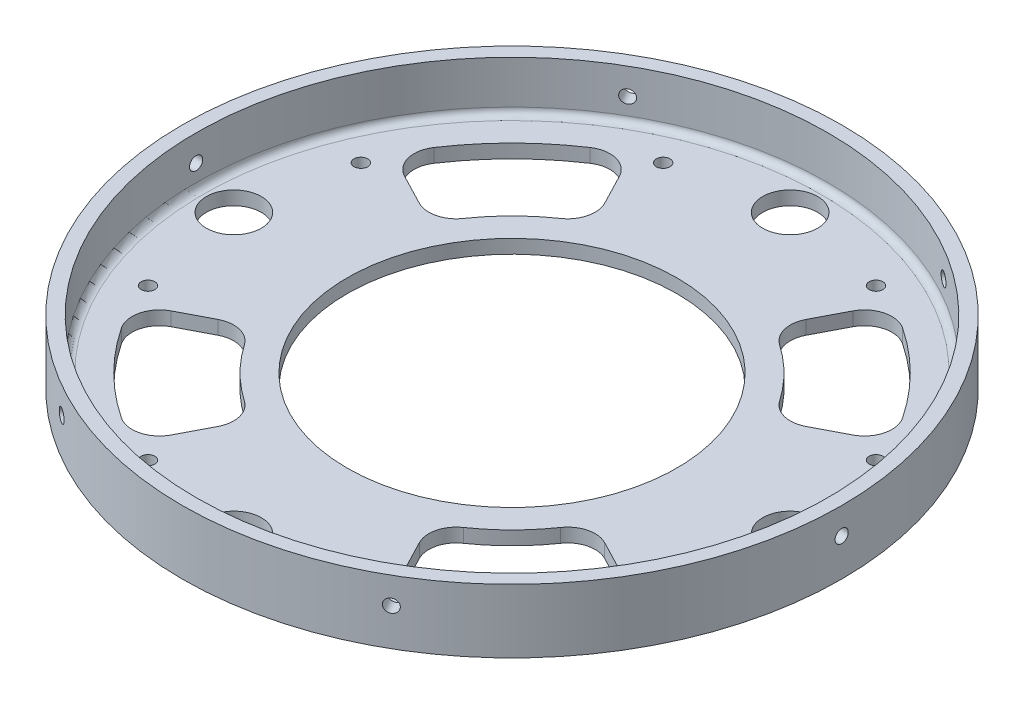
from build123d import *

# Parameters (mm, degrees)
SKETCH1_R           = 76.2
BOSS_EXTRUDE1_DEPTH = 16.256
SHELL1_T            = -3.175
FILLET1_R           = 1.5875
SKETCH2_R           = 38.1
CUT_EXTRUDE1_DEPTH  = 16.256
SKETCH3_R           = 1.524
CUT_EXTRUDE2_DEPTH  = 76.2
CIRPATTERN1_COUNT   = 6
CUT_EXTRUDE4_START  = -1.524
SKETCH5_R           = 76.2
CUT_EXTRUDE4_DEPTH  = 1.524
SKETCH6_R           = 6.35
CUT_EXTRUDE5_DEPTH  = 12.7
SKETCH7_R           = 1.5875
CUT_EXTRUDE6_DEPTH  = 6.35
SKETCH8_R           = 6.35
CUT_EXTRUDE7_DEPTH  = 6.35
CUT_EXTRUDE8_DEPTH  = 6.35
FILLET2_R           = 6.35


with BuildPart() as part:
    # Sketch1 → Boss-Extrude1 (new body)
    with BuildSketch(Plane(origin=(0, 0, 0), x_dir=(1, 0, 0), z_dir=(0, 1, 0))):
        with Locations(Location((0, 0, 0), (0, 0, 270))):
            Circle(SKETCH1_R)
    extrude(amount=BOSS_EXTRUDE1_DEPTH)

    # Shell1
    shell1_openings = [part.faces().sort_by_distance(p)[0] for p in [
        (0, 16.256, 0),
    ]]
    offset(amount=SHELL1_T, openings=shell1_openings, kind=Kind.INTERSECTION)

    # Fillet1
    fillet1_edges = [part.edges().sort_by_distance(p)[0] for p in [
        (0, 3.175, -73.025),
    ]]
    fillet(fillet1_edges, radius=FILLET1_R)

    # Sketch2 → Cut-Extrude1 (cut)
    with BuildSketch(Plane.XZ):
        with Locations(Location((0, 0, 0), (0, 0, 270))):
            Circle(SKETCH2_R)
    extrude(amount=-CUT_EXTRUDE1_DEPTH, mode=Mode.SUBTRACT)

    # Sketch3 → Cut-Extrude2 (cut)
    with BuildSketch(Plane(origin=(0, 0, 0), x_dir=(0, 0, -1), z_dir=(1, 0, 0))):
        with Locations((0, 8.636)):
            Circle(SKETCH3_R)
    cut_extrude2 = extrude(amount=-CUT_EXTRUDE2_DEPTH, mode=Mode.SUBTRACT)

    # CirPattern1: Cut-Extrude2 ×6 about axis
    cirpattern1_axis = Axis((0, 16.256, 0), (0, -1, 0))
    for i in range(1, CIRPATTERN1_COUNT):
        add(cut_extrude2.rotate(cirpattern1_axis, i * 360 / CIRPATTERN1_COUNT), mode=Mode.SUBTRACT)

    # Sketch5 → Cut-Extrude4 (cut)
    with BuildSketch(Plane(origin=(0, 16.256, 0), x_dir=(1, 0, 0), z_dir=(0, 1, 0)).offset(CUT_EXTRUDE4_START)):
        with Locations(Location((0, 0, 0), (0, 0, 270))):
            Circle(SKETCH5_R)
    extrude(amount=CUT_EXTRUDE4_DEPTH, mode=Mode.SUBTRACT)

    # Sketch6 → Cut-Extrude5 (cut)
    with BuildSketch(Plane(origin=(0, 3.175, 0), x_dir=(1, 0, 0), z_dir=(0, 1, 0))):
        with Locations(Location((0, 64.2874, 0), (0, 0, 270))):
            Circle(SKETCH6_R)
        with Locations(Location((0, -64.2874, 0), (0, 0, 270))):
            Circle(SKETCH6_R)
    extrude(amount=-CUT_EXTRUDE5_DEPTH, mode=Mode.SUBTRACT)

    # Sketch7 → Cut-Extrude6 (cut)
    with BuildSketch(Plane(origin=(0, 3.175, 0), x_dir=(1, 0, 0), z_dir=(0, 1, 0))):
        with Locations(Location((-24.6, 59.525, 0), (0, 0, 270))):
            Circle(SKETCH7_R)
        with Locations(Location((24.6, 59.525, 0), (0, 0, 270))):
            Circle(SKETCH7_R)
        with Locations(Location((24.6, -59.525, 0), (0, 0, 270))):
            Circle(SKETCH7_R)
        with Locations(Location((-24.6, -59.525, 0), (0, 0, 270))):
            Circle(SKETCH7_R)
        with Locations(Location((-59.525, -24.6, 0), (0, 0, 270))):
            Circle(SKETCH7_R)
        with Locations(Location((-59.525, 24.6, 0), (0, 0, 270))):
            Circle(SKETCH7_R)
        with Locations(Location((59.525, 24.6, 0), (0, 0, 270))):
            Circle(SKETCH7_R)
        with Locations(Location((59.525, -24.6, 0), (0, 0, 270))):
            Circle(SKETCH7_R)
    extrude(amount=-CUT_EXTRUDE6_DEPTH, mode=Mode.SUBTRACT)

    # Sketch8 → Cut-Extrude7 (cut)
    with BuildSketch(Plane(origin=(0, 3.175, 0), x_dir=(1, 0, 0), z_dir=(0, 1, 0))):
        with Locations(Location((0, 64.2874, 0), (0, 0, 270))):
            Circle(SKETCH8_R)
        with Locations(Location((0, -64.2874, 0), (0, 0, 270))):
            Circle(SKETCH8_R)
        with Locations(Location((64.2874, 0, 0), (0, 0, 270))):
            Circle(SKETCH8_R)
        with Locations(Location((-64.2874, 0, 0), (0, 0, 270))):
            Circle(SKETCH8_R)
    extrude(amount=-CUT_EXTRUDE7_DEPTH, mode=Mode.SUBTRACT)

    # Sketch9 → Cut-Extrude8 (cut)
    with BuildSketch(Plane(origin=(0, 3.175, 0), x_dir=(1, 0, 0), z_dir=(0, 1, 0))):
        with BuildLine():
            Line((-39.427631535, 20.524725858), (-57.733317604, 30.054062864))
            ThreePointArc((-57.733317604, 30.054062864), (-46.02381262, 46.02381262), (-30.054062864, 57.733317604))
            Line((-30.054062864, 57.733317604), (-20.524725858, 39.427631535))
            ThreePointArc((-20.524725858, 39.427631535), (-31.430896424, 31.430896424), (-39.427631535, 20.524725858))
        make_face()
        with BuildLine():
            Line((-20.524725858, -39.427631535), (-30.054062864, -57.733317604))
            ThreePointArc((-30.054062864, -57.733317604), (-46.02381262, -46.02381262), (-57.733317604, -30.054062864))
            Line((-57.733317604, -30.054062864), (-39.427631535, -20.524725858))
            ThreePointArc((-39.427631535, -20.524725858), (-31.430896424, -31.430896424), (-20.524725858, -39.427631535))
        make_face()
        with BuildLine():
            Line((39.427631535, -20.524725858), (57.733317604, -30.054062864))
            ThreePointArc((57.733317604, -30.054062864), (46.02381262, -46.02381262), (30.054062864, -57.733317604))
            Line((30.054062864, -57.733317604), (20.524725858, -39.427631535))
            ThreePointArc((20.524725858, -39.427631535), (31.430896424, -31.430896424), (39.427631535, -20.524725858))
        make_face()
        with BuildLine():
            Line((20.524725858, 39.427631535), (30.054062864, 57.733317604))
            ThreePointArc((30.054062864, 57.733317604), (46.02381262, 46.02381262), (57.733317604, 30.054062864))
            Line((57.733317604, 30.054062864), (39.427631535, 20.524725858))
            ThreePointArc((39.427631535, 20.524725858), (31.430896424, 31.430896424), (20.524725858, 39.427631535))
        make_face()
    extrude(amount=-CUT_EXTRUDE8_DEPTH, mode=Mode.SUBTRACT)

    # Fillet2
    fillet2_edges = [part.edges().sort_by_distance(p)[0] for p in [
        (-30.054062864, 1.5875, 57.733317604),
        (-57.733317604, 1.5875, 30.054062864),
        (-39.427631535, 1.5875, 20.524725858),
        (-20.524725858, 1.5875, 39.427631535),
        (-57.733317604, 1.5875, -30.054062864),
        (-30.054062864, 1.5875, -57.733317604),
        (-20.524725858, 1.5875, -39.427631535),
        (-39.427631535, 1.5875, -20.524725858),
        (20.524725858, 1.5875, 39.427631535),
        (39.427631535, 1.5875, 20.524725858),
        (57.733317604, 1.5875, 30.054062864),
        (30.054062864, 1.5875, 57.733317604),
        (30.054062864, 1.5875, -57.733317604),
        (57.733317604, 1.5875, -30.054062864),
        (39.427631535, 1.5875, -20.524725858),
        (20.524725858, 1.5875, -39.427631535),
    ]]
    fillet(fillet2_edges, radius=FILLET2_R)


solid = part.part
